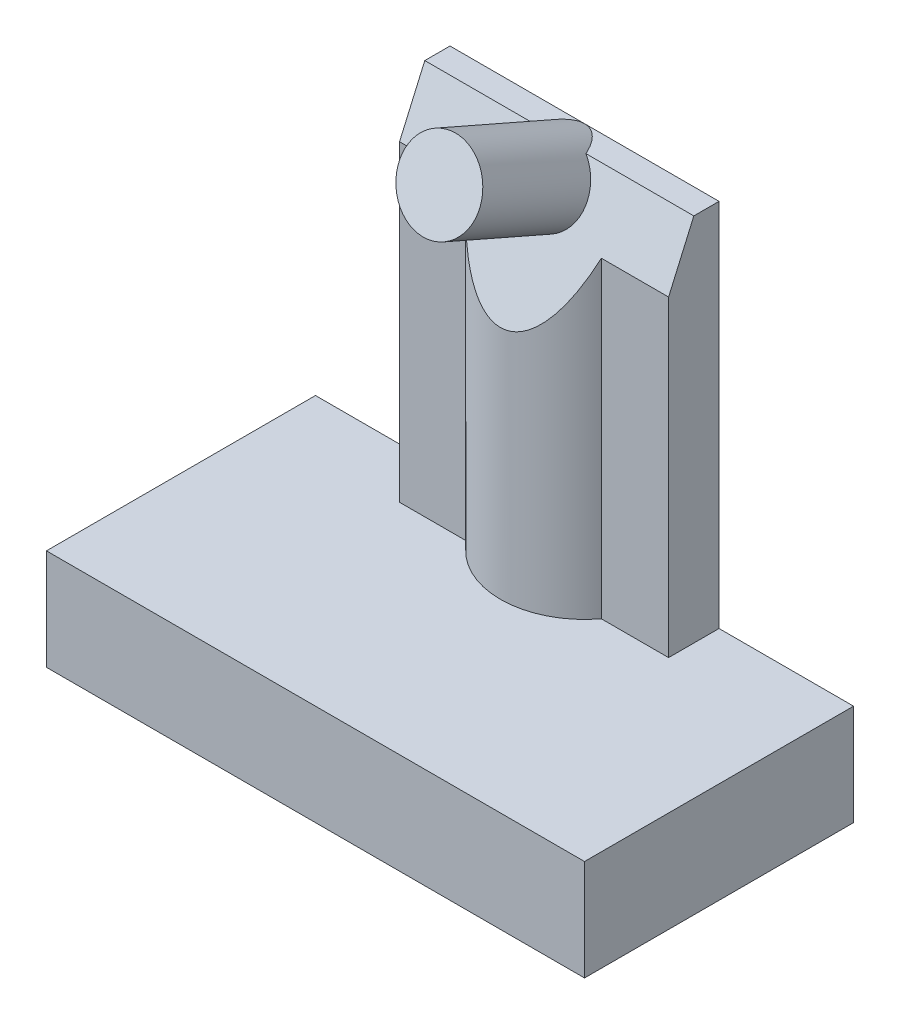
from build123d import *

# Parameters (mm, degrees)
SKETCH1_W                       = 16
SKETCH1_H                       = 8
BOSS_EXTRUDE1_DEPTH             = 3
SHELL1_T                        = -1
SKETCH3_R                       = 1.5
SKETCH3_R_2                     = 0.8
BOSS_EXTRUDE2_DEPTH             = 2
BOSS_EXTRUDE3_DEPTH             = 11
CUT_EXTRUDE1_REACH              = 20.868
SKETCH6_R                       = 1.2
BOSS_EXTRUDE5_DEPTH             = 3.5
BOSS_EXTRUDE5_DIRECTION_2_REACH = 18.513


with BuildPart() as part:
    # Sketch1 → Boss-Extrude1 (new body)
    with BuildSketch(Plane(origin=(0, 0, 0), x_dir=(1, 0, 0), z_dir=(0, 1, 0))):
        Rectangle(SKETCH1_W, SKETCH1_H)
    extrude(amount=BOSS_EXTRUDE1_DEPTH)

    # Shell1
    shell1_openings = [part.faces().sort_by_distance(p)[0] for p in [
        (0, 0, 0),
    ]]
    offset(amount=SHELL1_T, openings=shell1_openings, kind=Kind.INTERSECTION)

    # Sketch3 → Boss-Extrude2 (add)
    with BuildSketch(Plane.XZ.offset(-2)):
        with Locations(Location((0, 0, 0), (0, 0, 270))):
            Circle(SKETCH3_R)
        with Locations(Location((0, 0, 0), (0, 0, 270))):
            Circle(SKETCH3_R_2, mode=Mode.SUBTRACT)
    extrude(amount=BOSS_EXTRUDE2_DEPTH)

    # Sketch4 → Boss-Extrude3 (add)
    with BuildSketch(Plane(origin=(0, 3, 0), x_dir=(1, 0, 0), z_dir=(0, 1, 0))):
        with BuildLine():
            Line((-4, 4), (4, 4))
            Line((4, 4), (4, 2.5))
            Line((4, 2.5), (2, 2.5))
            ThreePointArc((2, 2.5), (0, 1.5), (-2, 2.5))
            Line((-2, 2.5), (-4, 2.5))
            Line((-4, 2.5), (-4, 4))
        make_face()
    extrude(amount=BOSS_EXTRUDE3_DEPTH)

    # Sketch5 → Cut-Extrude1 (cut, up to next)
    with BuildSketch(Plane(origin=(4, 0, 0), x_dir=(0, 0, -1), z_dir=(1, 0, 0)), mode=Mode.PRIVATE) as cut_extrude1_sk1:
        Polygon((3.25, 14), (1.5, 14), (1.5, 10), align=None)
    cut_extrude1_tool1 = extrude(cut_extrude1_sk1.sketch, amount=-CUT_EXTRUDE1_REACH, mode=Mode.PRIVATE) & part.part
    add(cut_extrude1_tool1.solids().sort_by_distance((4, 12.666667, -2.083333))[0], mode=Mode.SUBTRACT)

    # Sketch6 → Boss-Extrude5 (add)
    with BuildSketch(Plane(origin=(0, 1.055737705, 2.413114754), x_dir=(1, 0, 0), z_dir=(0, 0.400818834019708, 0.9161573349021891))):
        with Locations(Location((0, 13.229478025, 0), (0, 0, 270))):
            Circle(SKETCH6_R)
    extrude(amount=BOSS_EXTRUDE5_DEPTH)

    # Sketch6 → Boss-Extrude5 direction 2 (add, up to next)
    with BuildSketch(Plane(origin=(0, 1.055737705, 2.413114754), x_dir=(1, 0, 0), z_dir=(0, 0.400818834019708, 0.9161573349021891)), mode=Mode.PRIVATE) as boss_extrude5_direction_2_sk1:
        with Locations(Location((0, 13.229478025, 0), (0, 0, 270))):
            Circle(SKETCH6_R)
    boss_extrude5_direction_2_tool1 = extrude(boss_extrude5_direction_2_sk1.sketch, amount=-BOSS_EXTRUDE5_DIRECTION_2_REACH, mode=Mode.PRIVATE) - part.part
    add(boss_extrude5_direction_2_tool1.solids().sort_by_distance((0, 13.176021, -2.889509))[0])


solid = part.part
